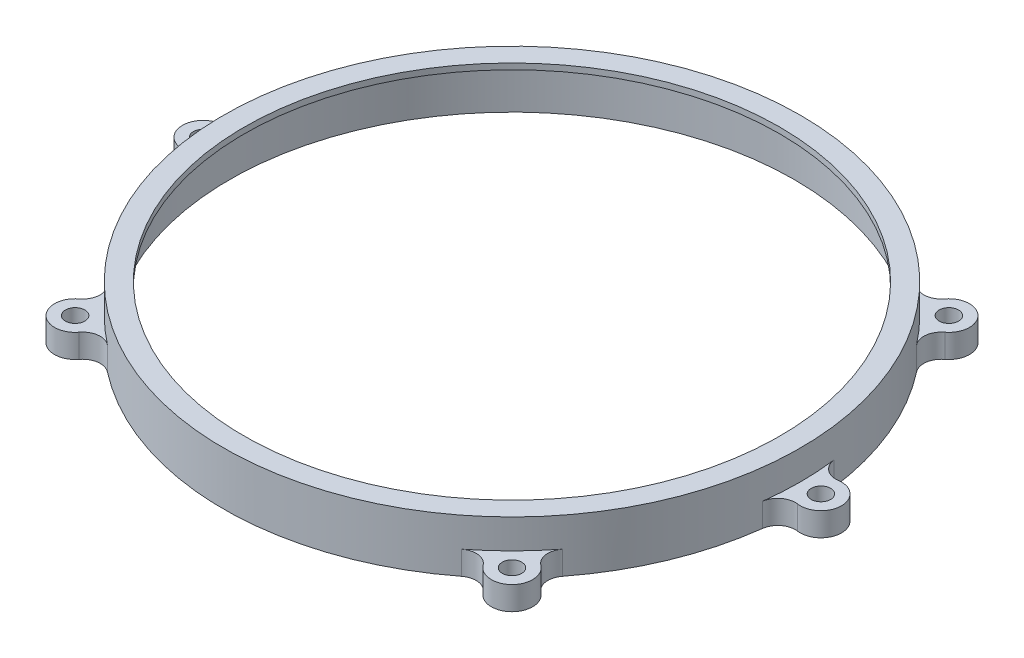
from build123d import *

# Parameters (mm, degrees)
HOLE_WIZARD_M4_1_D  = 3.3
SKETCH_5_OUTSIDE_W  = 145.73
SKETCH_5_OUTSIDE_H  = 145.73
CUT_EXTRUDE_1_DEPTH = 80.7057087039567


with BuildPart() as part:
    # 草图1 → 旋转1 (revolve)
    with BuildSketch(Plane.XY, mode=Mode.PRIVATE) as revolve_1_sk:
        Polygon((48, 8), (48, 0), (56, 0), (56, 4), (49, 3.999999999999999), (49, 9.000000000000002), (45.5, 9.000000000000002), (45.5, 8), align=None)
    revolve(revolve_1_sk.sketch.rotate(Axis((0, 0, 0), (0, 1, 0)), 90), axis=Axis((0, 0, 0), (0, 1, 0)))

    # M4 螺纹孔1 (through all)
    with Locations(Plane(origin=(0, 0, 0), x_dir=(-1, 0, 0), z_dir=(0, -1, 0))):
        with Locations((0, 52.5), (37.123106012, 37.123106012), (52.5, 0), (37.123106012, -37.123106012), (0, -52.5), (-37.123106012, -37.123106012), (-52.5, 0), (-37.123106012, 37.123106012)):
            Hole(HOLE_WIZARD_M4_1_D / 2)

    # 草图5 outside → 切除-拉伸1 (cut, through all)
    with BuildSketch(Plane(origin=(0, 0, 0), x_dir=(1, 0, 0), z_dir=(0, 1, 0))):
        Rectangle(SKETCH_5_OUTSIDE_W, SKETCH_5_OUTSIDE_H)
        with BuildLine():
            ThreePointArc((-34.32939590334373, 39.23146647178603), (-39.59797974644666, 39.59797974644667), (-39.231466471786035, 34.32939590334374))
            ThreePointArc((-39.231466471786035, 34.32939590334374), (-38.06453796581761, 32.32818427252133), (-38.671019161849834, 30.09239566707582))
            ThreePointArc((-38.671019161849834, 30.09239566707582), (-45.27009709305295, 18.75148818588967), (-48.62307692307686, 6.066002846401533))
            ThreePointArc((-48.62307692307686, 6.066002846401533), (-49.775171240910495, 4.056214595814896), (-52.01538461538459, 3.466287340801167))
            ThreePointArc((-52.01538461538459, 3.466287340801167), (-56.00000000000002, 6.7886e-13), (-52.015384615384676, -3.4662873407999144))
            ThreePointArc((-52.015384615384676, -3.4662873407999144), (-49.7751712409106, -4.056214595813701), (-48.623076923077015, -6.066002846400361))
            ThreePointArc((-48.623076923077015, -6.066002846400361), (-45.27009709305327, -18.75148818588891), (-38.67101916185015, -30.092395667075422))
            ThreePointArc((-38.67101916185015, -30.092395667075422), (-38.06453796581794, -32.328184272520936), (-39.23146647178639, -34.32939590334334))
            ThreePointArc((-39.23146647178639, -34.32939590334334), (-39.59797974644708, -39.597979746446256), (-34.32939590334415, -39.23146647178569))
            ThreePointArc((-34.32939590334415, -39.23146647178569), (-32.328184272521725, -38.06453796581728), (-30.092395667076225, -38.67101916184953))
            ThreePointArc((-30.092395667076225, -38.67101916184953), (-18.751488185889833, -45.27009709305289), (-6.06600284640136, -48.62307692307687))
            ThreePointArc((-6.06600284640136, -48.62307692307687), (-4.2133e-13, -49), (6.066002846400527, -48.62307692307699))
            ThreePointArc((6.066002846400527, -48.62307692307699), (18.751488185889055, -45.27009709305321), (30.09239566707555, -38.67101916185003))
            ThreePointArc((30.09239566707555, -38.67101916185003), (32.32818427252106, -38.06453796581782), (34.32939590334346, -39.23146647178626))
            ThreePointArc((34.32939590334346, -39.23146647178626), (39.597979746446384, -39.59797974644694), (39.2314664717858, -34.32939590334401))
            ThreePointArc((39.2314664717858, -34.32939590334401), (38.06453796581738, -32.32818427252158), (38.67101916184963, -30.092395667076087))
            ThreePointArc((38.67101916184963, -30.092395667076087), (45.27009709305294, -18.75148818588968), (48.623076923076894, -6.066002846401207))
            ThreePointArc((48.623076923076894, -6.066002846401207), (49.77517124091051, -4.056214595814549), (52.015384615384605, -3.4662873408008132))
            ThreePointArc((52.015384615384605, -3.4662873408008132), (56.00000000000002, -2.9896e-13), (52.015384615384654, 3.466287340800272))
            ThreePointArc((52.015384615384654, 3.466287340800272), (49.77517124091057, 4.056214595814031), (48.623076923076965, 6.0660028464006865))
            ThreePointArc((48.623076923076965, 6.0660028464006865), (45.270097093053266, 18.751488185888892), (38.67101916185035, 30.092395667075152))
            ThreePointArc((38.67101916185035, 30.092395667075152), (38.06453796581817, 32.32818427252066), (39.23146647178663, 34.329395903343055))
            ThreePointArc((39.23146647178663, 34.329395903343055), (39.597979746447365, 39.59797974644598), (34.32939590334443, 39.231466471785446))
            ThreePointArc((34.32939590334443, 39.231466471785446), (32.32818427252199, 38.06453796581705), (30.092395667076495, 38.67101916184932))
            ThreePointArc((30.092395667076495, 38.67101916184932), (18.75148818589015, 45.270097093052755), (6.0660028464017035, 48.62307692307684))
            ThreePointArc((6.0660028464017035, 48.62307692307684), (7.6461e-13, 49.00000000000001), (-6.066002846400184, 48.62307692307702))
            ThreePointArc((-6.066002846400184, 48.62307692307702), (-18.751488185889055, 45.270097093053195), (-30.092395667075817, 38.67101916184983))
            ThreePointArc((-30.092395667075817, 38.67101916184983), (-32.32818427252132, 38.0645379658176), (-34.32939590334373, 39.23146647178603))
        make_face(mode=Mode.SUBTRACT)
    extrude(amount=CUT_EXTRUDE_1_DEPTH, mode=Mode.SUBTRACT)


solid = part.part
